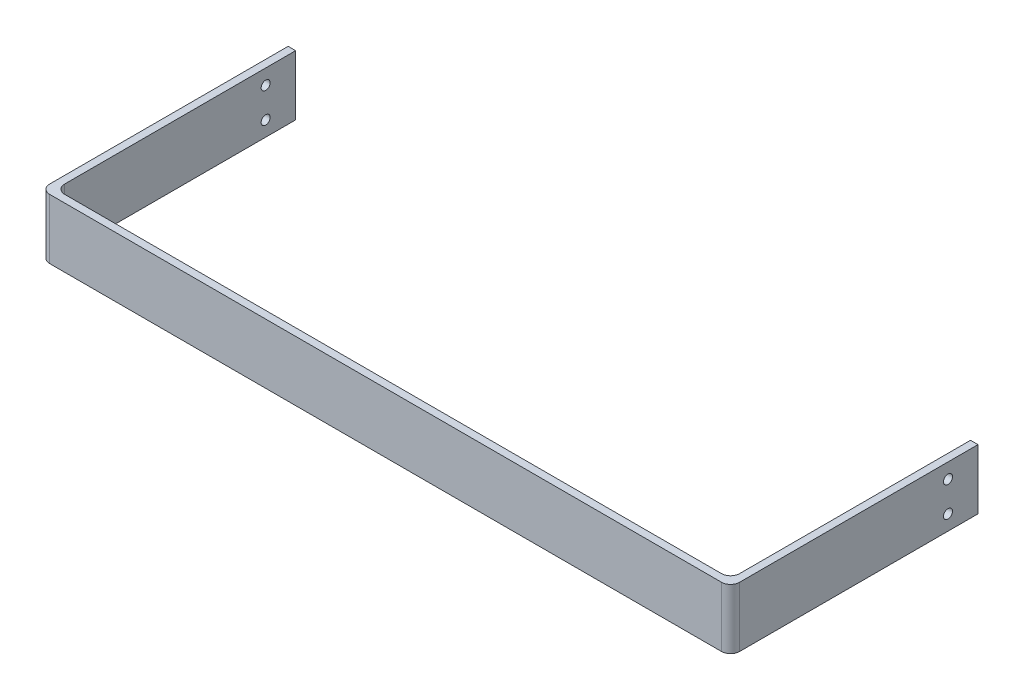
from build123d import *

# Parameters (mm, degrees)
EXTRUDE_THIN1_DEPTH = 20
FILLET1_R           = 3
SKETCH2_R           = 1.5
CUT_EXTRUDE1_DEPTH  = 270


with BuildPart() as part:
    # Sketch1 → Extrude-Thin1 (new body)
    with BuildSketch(Plane(origin=(0, 0, 0), x_dir=(1, 0, 0), z_dir=(0, 1, 0))):
        Polygon((0, 80), (0, 0), (225, 0), (225, 80), (227.5, 80), (227.5, -2.5), (-2.5, -2.5), (-2.5, 80), align=None)
    extrude(amount=EXTRUDE_THIN1_DEPTH)

    # Fillet1
    fillet1_edges = [part.edges().sort_by_distance(p)[0] for p in [
        (227.5, 10, 2.5),
        (-2.5, 10, 2.5),
        (0, 10, 0),
        (225, 10, 0),
    ]]
    fillet(fillet1_edges, radius=FILLET1_R)

    # Sketch2 → Cut-Extrude1 (cut)
    with BuildSketch(Plane(origin=(-2.5, 0, 0), x_dir=(0, 0, -1), z_dir=(1, 0, 0))):
        with Locations((70, 15)):
            Circle(SKETCH2_R)
        with Locations((70, 5)):
            Circle(SKETCH2_R)
    extrude(amount=CUT_EXTRUDE1_DEPTH, mode=Mode.SUBTRACT)


solid = part.part
